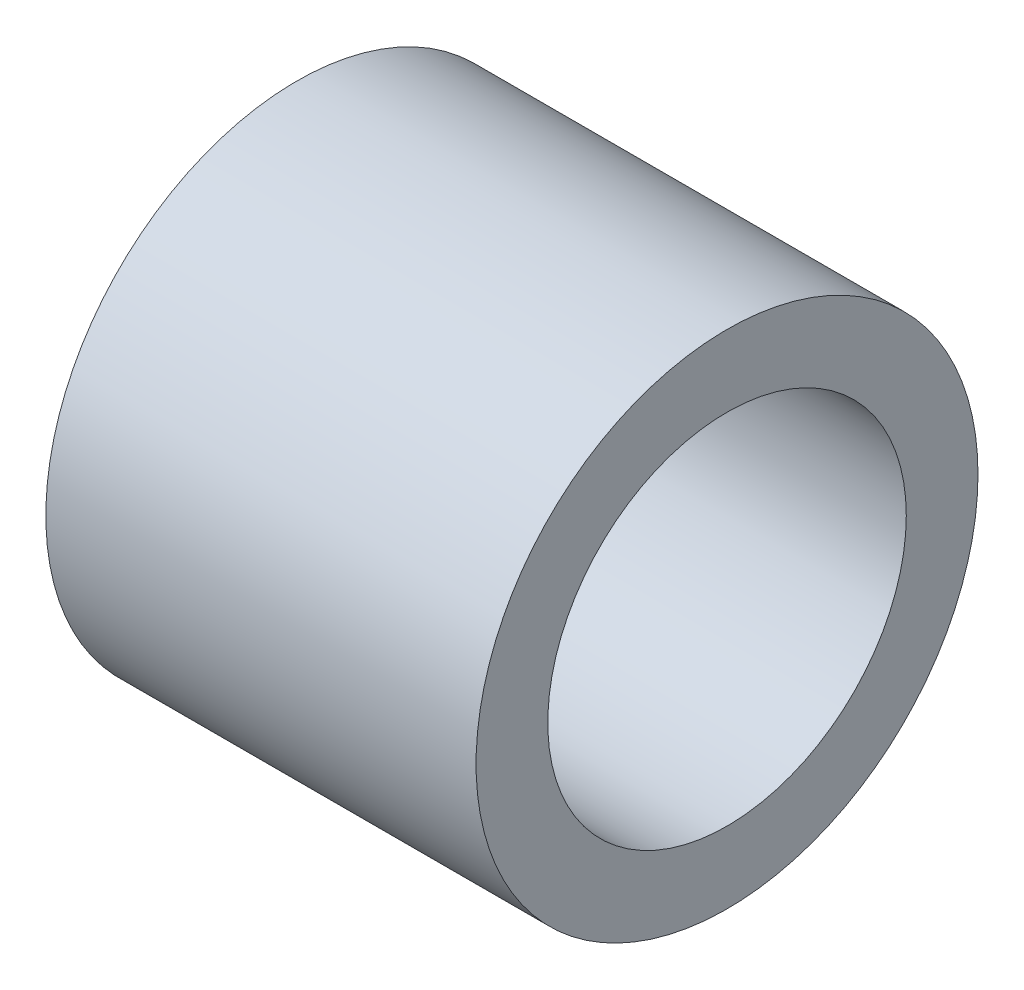
from build123d import *

# Parameters (mm, degrees)
SKETCH1_R           = 14
SKETCH1_R_2         = 10
EXTRUDE_THIN1_DEPTH = 24


with BuildPart() as part:
    # Sketch1 → Extrude-Thin1 (new body)
    with BuildSketch(Plane(origin=(0, 0, 0), x_dir=(0, 0, -1), z_dir=(1, 0, 0))):
        Circle(SKETCH1_R)
        Circle(SKETCH1_R_2, mode=Mode.SUBTRACT)
    extrude(amount=EXTRUDE_THIN1_DEPTH)


solid = part.part
